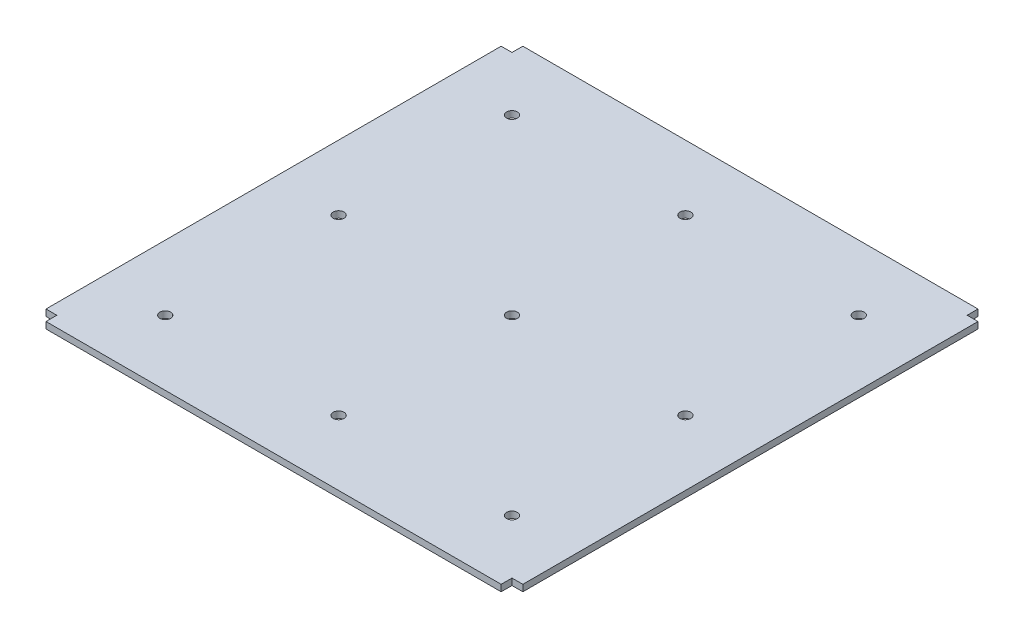
from build123d import *

# Parameters (mm, degrees)
BOSS_EXTRUDE1_DEPTH  = 3
SKETCH2_R            = 2.5
CUT_EXTRUDE1_DEPTH   = 305.070715459
LPATTERN1_COUNT      = 3
LPATTERN1_PITCH      = 80
LPATTERN1_COUNT_DIR2 = 3
LPATTERN1_PITCH_DIR2 = 80


with BuildPart() as part:
    # Sketch1 → Boss-Extrude1 (new body)
    with BuildSketch(Plane(origin=(0, 0, 0), x_dir=(1, 0, 0), z_dir=(0, 1, 0))):
        Polygon((0, -5), (210, -5), (210, 0), (215, 0), (215, 210), (210, 210), (210, 215), (0, 215), (0, 210), (-5, 210), (-5, 0), (0, 0), align=None)
    extrude(amount=BOSS_EXTRUDE1_DEPTH)

    # Sketch2 → Cut-Extrude1 (cut, through all)
    with BuildSketch(Plane(origin=(0, 3, 0), x_dir=(1, 0, 0), z_dir=(0, 1, 0))):
        with Locations(Location((25, 25, 0), (0, 0, 270))):
            Circle(SKETCH2_R)
    cut_extrude1 = extrude(amount=-CUT_EXTRUDE1_DEPTH, mode=Mode.SUBTRACT)

    # LPattern1: Cut-Extrude1 3 × 3
    with Locations(*[(i * LPATTERN1_PITCH, 0, -j * LPATTERN1_PITCH_DIR2) for i in range(LPATTERN1_COUNT) for j in range(LPATTERN1_COUNT_DIR2) if (i, j) != (0, 0)]):
        add(cut_extrude1, mode=Mode.SUBTRACT)


solid = part.part
